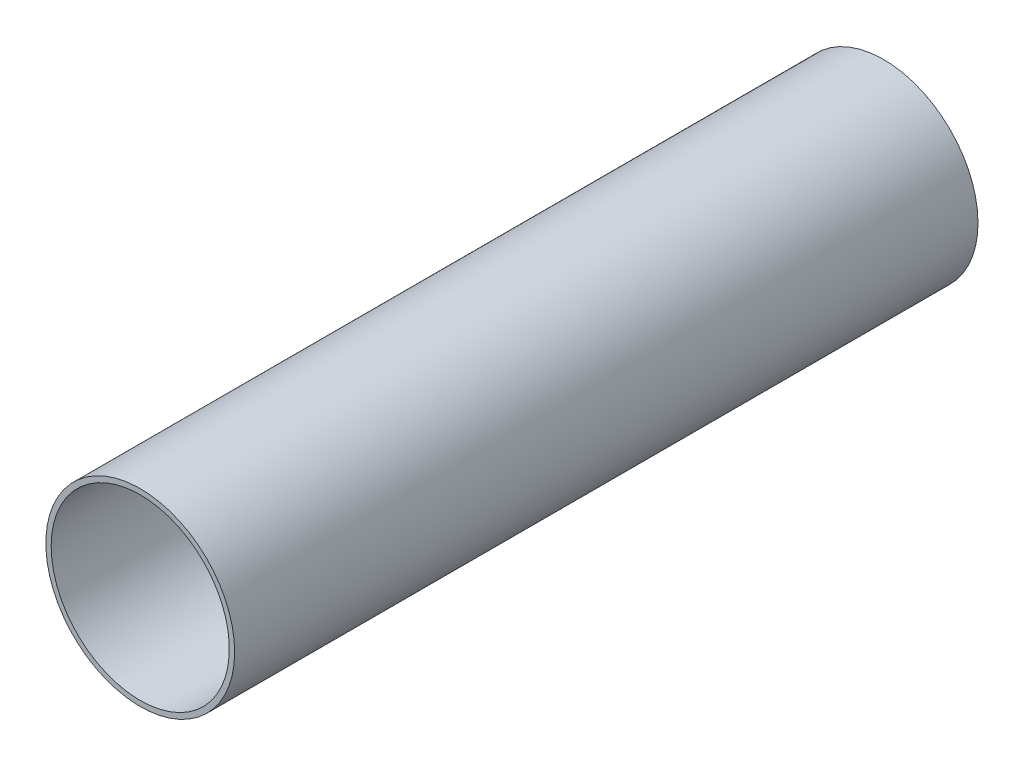
from build123d import *

# Parameters (mm, degrees)
CROQUIS1_R              = 19.05
SALIENTE_EXTRUIR1_DEPTH = 150
CROQUIS2_R              = 17.9788625
CORTAR_EXTRUIR1_DEPTH   = 150


with BuildPart() as part:
    # Croquis1 → Saliente-Extruir1 (new body)
    with BuildSketch(Plane.XY):
        Circle(CROQUIS1_R)
    extrude(amount=SALIENTE_EXTRUIR1_DEPTH)

    # Croquis2 → Cortar-Extruir1 (cut)
    with BuildSketch(Plane(origin=(0, 0, 0), x_dir=(-1, 0, 0), z_dir=(0, 0, -1))):
        Circle(CROQUIS2_R)
    extrude(amount=-CORTAR_EXTRUIR1_DEPTH, mode=Mode.SUBTRACT)


solid = part.part
